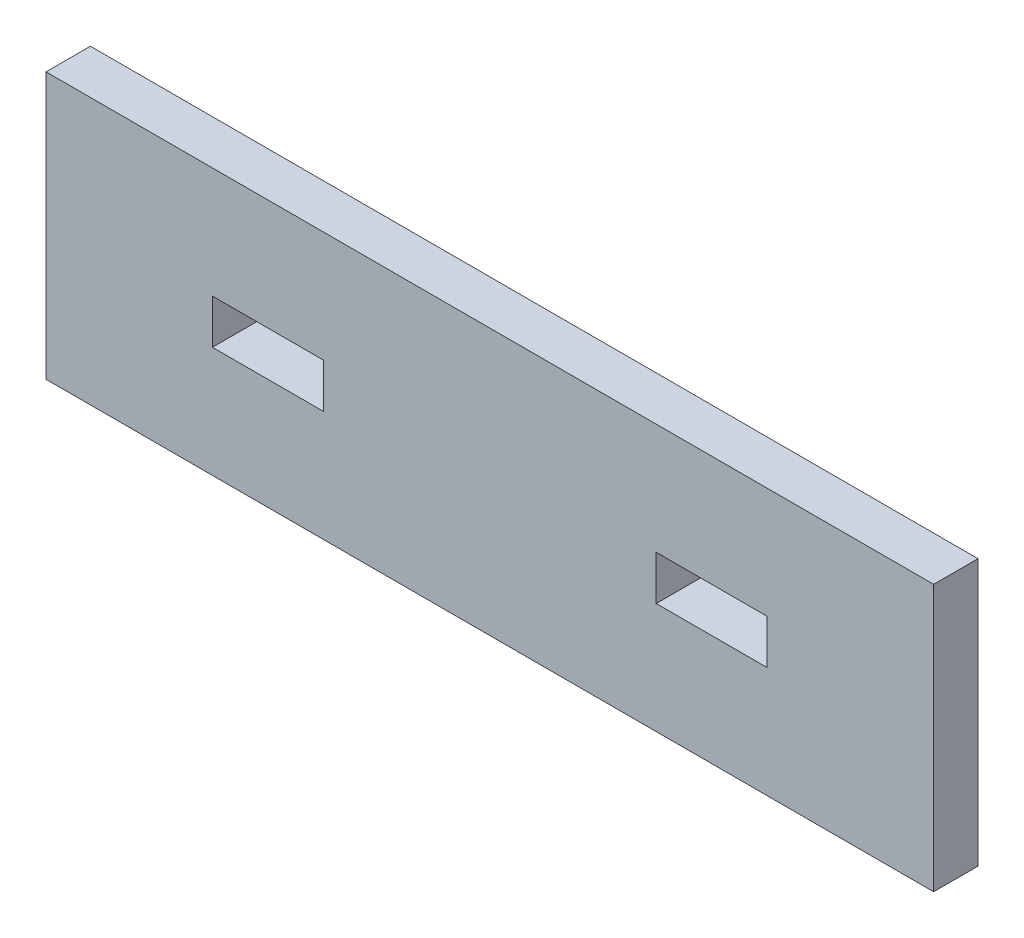
from build123d import *

# Parameters (mm, degrees)
SKETCH1_W           = 80
SKETCH1_H           = 24
SKETCH1_W_2         = 10
SKETCH1_H_2         = 4
BOSS_EXTRUDE1_DEPTH = 4


with BuildPart() as part:
    # Sketch1 → Boss-Extrude1 (new body)
    with BuildSketch(Plane.XY):
        with Locations((40, 12)):
            Rectangle(SKETCH1_W, SKETCH1_H)
        with Locations((20, 12)):
            Rectangle(SKETCH1_W_2, SKETCH1_H_2, mode=Mode.SUBTRACT)
        with Locations((60, 12)):
            Rectangle(SKETCH1_W_2, SKETCH1_H_2, mode=Mode.SUBTRACT)
    extrude(amount=BOSS_EXTRUDE1_DEPTH)


solid = part.part
